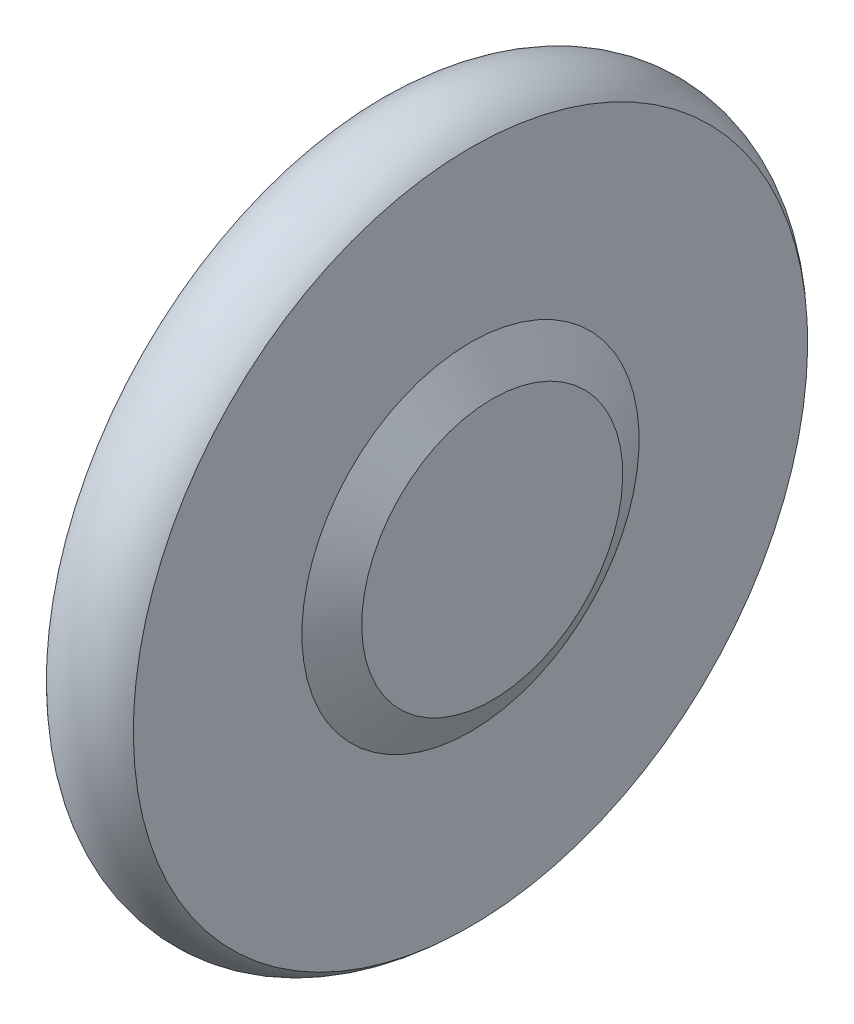
from build123d import *


with BuildPart() as part:
    # 草图1 → 旋转1 (revolve)
    with BuildSketch(Plane.XY):
        with BuildLine():
            Line((0, 0), (20, 0))
            Line((20, 0), (30, 0))
            Line((30, 0), (30, 60))
            Line((30, 60), (20, 77.5))
            Line((20, 77.5), (20, 155))
            ThreePointArc((20, 155), (0, 163.284271247), (-20, 155))
            Line((-20, 155), (-20, 77.5))
            Line((-20, 77.5), (-30, 60))
            Line((-30, 60), (-30, 8))
            Line((-30, 8), (-50, 8))
            Line((-50, 8), (-50, 0))
            Line((-50, 0), (-30, 0))
            Line((-30, 0), (-20, 0))
            Line((-20, 0), (0, 0))
        make_face()
    revolve(axis=Axis((0, 0, 0), (-1, 0, 0)))


solid = part.part
